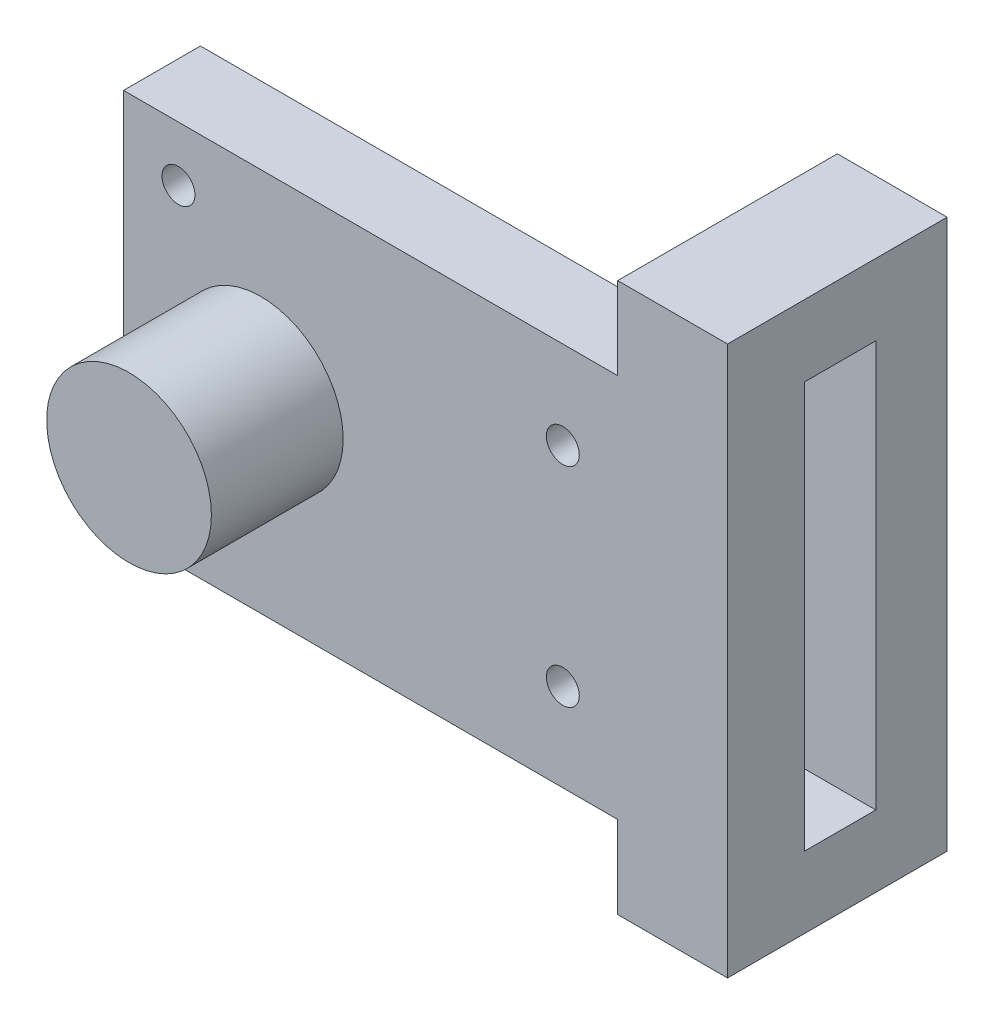
from build123d import *

# Parameters (mm, degrees)
SKETCH1_R           = 1.5
BOSS_EXTRUDE1_DEPTH = 7
SKETCH2_W           = 7
SKETCH2_H           = 50
BOSS_EXTRUDE2_DEPTH = 10
SKETCH3_W           = 10
SKETCH3_H           = 6.5
BOSS_EXTRUDE3_DEPTH = 6.5
SKETCH4_W           = 10
SKETCH4_H           = 50
BOSS_EXTRUDE4_DEPTH = 6.5
SKETCH5_R           = 7.5
BOSS_EXTRUDE5_DEPTH = 12
SKETCH1_3_R         = 4.25
CUT_EXTRUDE1_DEPTH  = 16


with BuildPart() as part:
    # Sketch1 → Boss-Extrude1 (new body)
    with BuildSketch(Plane.XY):
        Polygon((-47.5, 17.5), (-92.5, 17.5), (-92.5, 0), (-92.5, -17.5), (-47.5, -17.5), align=None)
        with Locations((-87.5, -12.5)):
            Circle(SKETCH1_R, mode=Mode.SUBTRACT)
        with Locations((-52.5, -9.5)):
            Circle(SKETCH1_R, mode=Mode.SUBTRACT)
        with Locations((-87.5, 12.5)):
            Circle(SKETCH1_R, mode=Mode.SUBTRACT)
        with Locations((-52.5, 9.5)):
            Circle(SKETCH1_R, mode=Mode.SUBTRACT)
    extrude(amount=BOSS_EXTRUDE1_DEPTH)

    # Sketch2 → Boss-Extrude2 (add)
    with BuildSketch(Plane(origin=(-47.5, 0, 0), x_dir=(0, 0, -1), z_dir=(1, 0, 0))):
        with Locations((-3.5, 0)):
            Rectangle(SKETCH2_W, SKETCH2_H)
    extrude(amount=BOSS_EXTRUDE2_DEPTH)

    # Sketch3 → Boss-Extrude3 (add)
    with BuildSketch(Plane(origin=(0, 0, 0), x_dir=(-1, 0, 0), z_dir=(0, 0, -1))):
        with Locations((42.5, 21.75)):
            Rectangle(SKETCH3_W, SKETCH3_H)
        with Locations((42.5, -21.75)):
            Rectangle(SKETCH3_W, SKETCH3_H)
    extrude(amount=BOSS_EXTRUDE3_DEPTH)

    # Sketch4 → Boss-Extrude4 (add)
    with BuildSketch(Plane(origin=(0, 0, -6.5), x_dir=(-1, 0, 0), z_dir=(0, 0, -1))):
        with Locations((42.5, 0)):
            Rectangle(SKETCH4_W, SKETCH4_H)
    extrude(amount=BOSS_EXTRUDE4_DEPTH)

    # Sketch5 → Boss-Extrude5 (add)
    with BuildSketch(Plane.XY.offset(7)):
        with Locations((-80, 0)):
            Circle(SKETCH5_R)
    extrude(amount=BOSS_EXTRUDE5_DEPTH)

    # Sketch1<3> → Cut-Extrude1 (cut)
    with BuildSketch(Plane.XY):
        with Locations((-80, 0)):
            Circle(SKETCH1_3_R)
    extrude(amount=CUT_EXTRUDE1_DEPTH, mode=Mode.SUBTRACT)


solid = part.part
